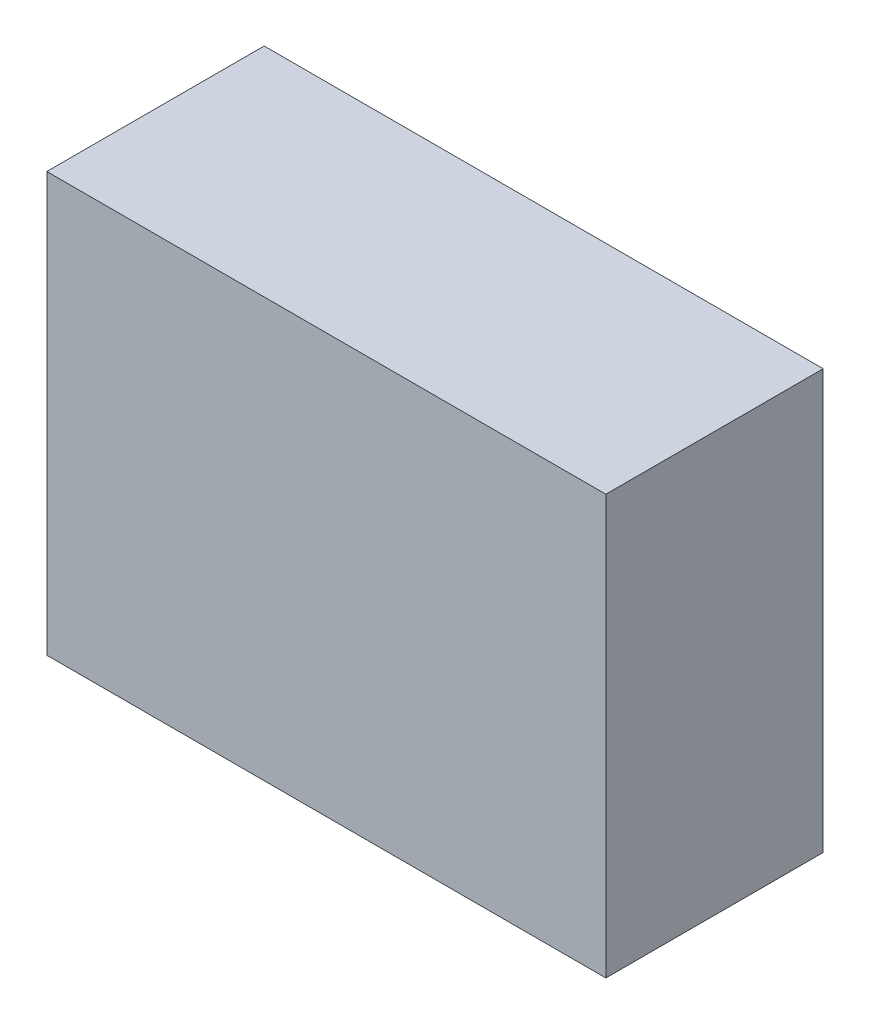
from build123d import *

# Parameters (mm, degrees)
SKETCH1_W      = 46.3
SKETCH1_H      = 34.7
ENVELOPE_DEPTH = 18


with BuildPart() as part:
    # Sketch1 → Envelope (new body)
    with BuildSketch(Plane.XY):
        Rectangle(SKETCH1_W, SKETCH1_H)
    extrude(amount=ENVELOPE_DEPTH)


solid = part.part
